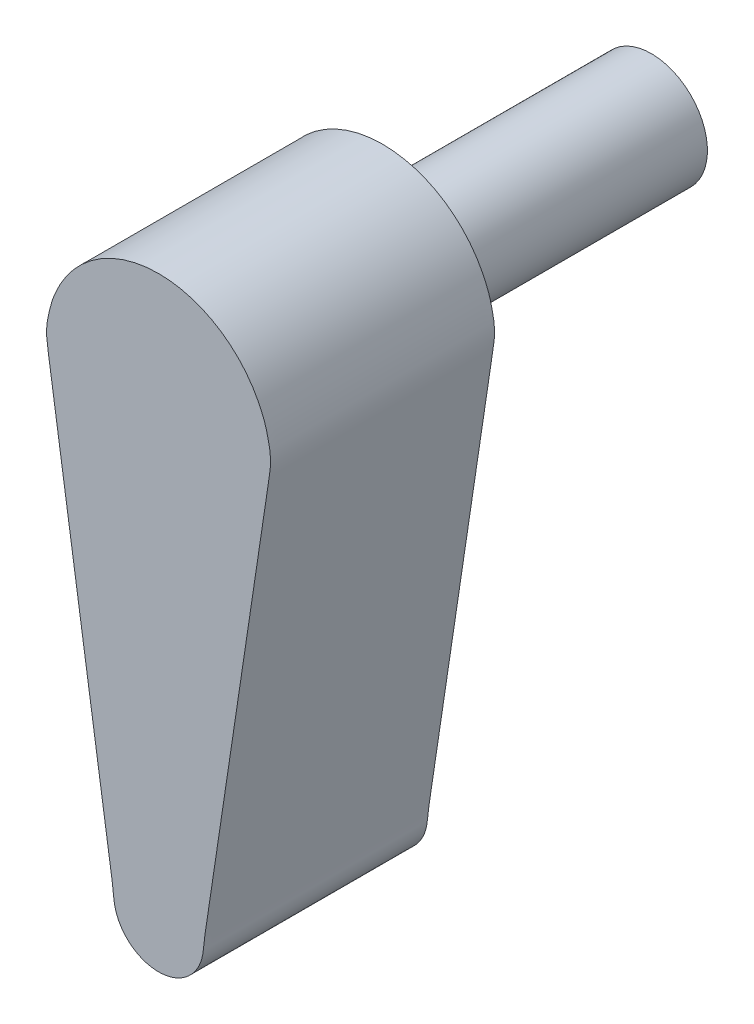
from build123d import *

# Parameters (mm, degrees)
BOSS_EXTRUDE1_DEPTH = 5
SKETCH2_R           = 1.25
BOSS_EXTRUDE2_DEPTH = 6


with BuildPart() as part:
    # Sketch1 → Boss-Extrude1 (new body)
    with BuildSketch(Plane.XY):
        with BuildLine():
            add(Edge.make_bspline(
                [(2.231165341, 12.127785983), (1.172921657, 14.221371702), (-1.172921657, 14.221371702), (-2.231165341, 12.127785983), (-2.26042177, 12.069906268), (-2.314430173, 11.951869974), (-2.386748573, 11.768950746), (-2.416824724, 11.642778542), (-2.4318628, 11.579692439), (-2.452629849, 11.492572768), (-2.494163948, 11.318333424), (-2.506012881, 11.040085874), (-2.47944195, 10.862946336), (-2.466156485, 10.774376568), (-2.445087982, 10.633919883), (-2.402950977, 10.353006512), (-2.339745469, 9.931636457), (-2.297608463, 9.650723087), (-2.27653996, 9.510266402), (-1.864051859, 6.760345727), (-1.451563758, 4.010425052), (-1.039075657, 1.260504377), (-1.030292304, 1.201948693), (-1.012725599, 1.084837324), (-1.000985249, 0.906957534), (-0.9794986, 0.790027603), (-0.963687366, 0.73296693), (-0.628191537, -0.477793565), (0.628191537, -0.477793565), (0.963687366, 0.73296693), (0.9794986, 0.790027603), (1.000985249, 0.906957534), (1.012725599, 1.084837324), (1.030292304, 1.201948693), (1.039075657, 1.260504377), (1.451563758, 4.010425052), (1.864051859, 6.760345727), (2.27653996, 9.510266402), (2.297608463, 9.650723087), (2.339745469, 9.931636457), (2.402950977, 10.353006512), (2.445087982, 10.633919883), (2.466156485, 10.774376568), (2.47944195, 10.862946336), (2.506012881, 11.040085874), (2.494163948, 11.318333424), (2.452629849, 11.492572768), (2.4318628, 11.579692439), (2.416824724, 11.642778542), (2.386748573, 11.768950746), (2.314430173, 11.951869974), (2.26042177, 12.069906268), (2.231165341, 12.127785983)],
                knots=[0, 0, 0, 0, 0.151390805, 0.151390805, 0.151390805, 0.15799156, 0.164592315, 0.171193071, 0.171193071, 0.171193071, 0.18030848, 0.189423889, 0.198539298, 0.198539298, 0.198539298, 0.212994797, 0.227450295, 0.241905794, 0.241905794, 0.241905794, 0.524921688, 0.524921688, 0.524921688, 0.530948113, 0.536974537, 0.543000962, 0.543000962, 0.543000962, 0.608389843, 0.608389843, 0.608389843, 0.614416268, 0.620442692, 0.626469117, 0.626469117, 0.626469117, 0.909485011, 0.909485011, 0.909485011, 0.923940509, 0.938396008, 0.952851506, 0.952851506, 0.952851506, 0.961966915, 0.971082325, 0.980197734, 0.980197734, 0.980197734, 0.986798489, 0.993399245, 1, 1, 1, 1], degree=3, weights=[1, 0.634076262, 0.634076262, 1, 1, 1, 1, 1, 1, 1, 1, 1, 1, 1, 1, 1, 1, 1, 1, 1, 1, 1, 1, 1, 1, 1, 1, 0.51135538, 0.51135538, 1, 1, 1, 1, 1, 1, 1, 1, 1, 1, 1, 1, 1, 1, 1, 1, 1, 1, 1, 1, 1, 1, 1, 1]))
        make_face()
    extrude(amount=BOSS_EXTRUDE1_DEPTH)

    # Sketch2 → Boss-Extrude2 (add)
    with BuildSketch(Plane(origin=(0, 0, 0), x_dir=(-1, 0, 0), z_dir=(0, 0, -1))):
        with Locations((0, 11)):
            Circle(SKETCH2_R)
    extrude(amount=BOSS_EXTRUDE2_DEPTH)


solid = part.part
